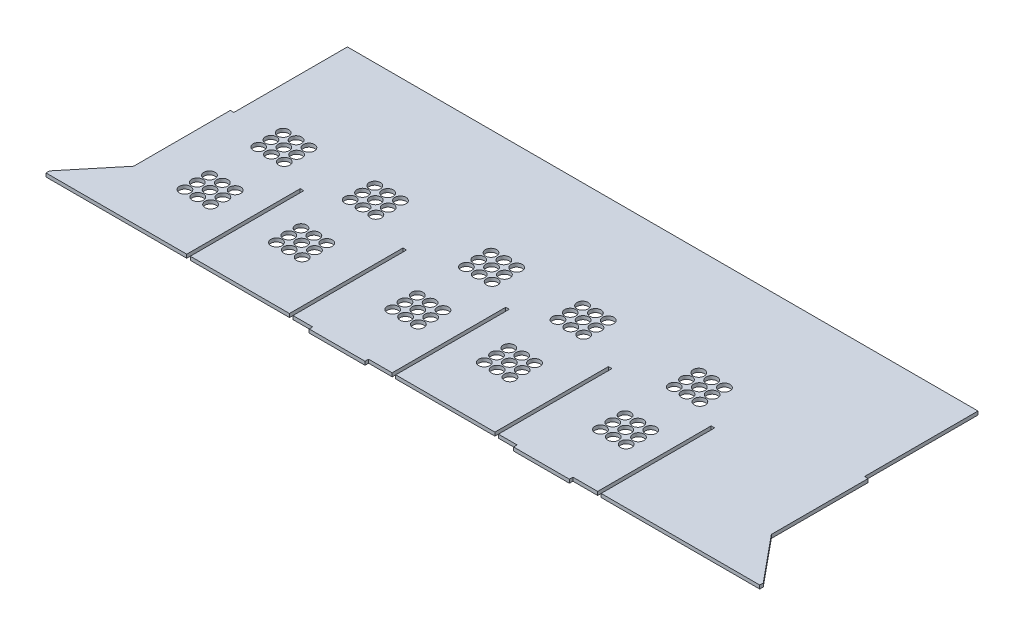
from build123d import *

# Parameters (mm, degrees)
SKETCH1_W           = 570.861
SKETCH1_H           = 3.175
BOSS_EXTRUDE1_DEPTH = 232.6
SKETCH6_W           = 50
SKETCH6_H           = 3.175
BOSS_EXTRUDE2_DEPTH = 3.175
SKETCH2_W           = 3.175
SKETCH2_H           = 101.6
CUT_EXTRUDE5_DEPTH  = 371.230335845
BOSS_EXTRUDE3_DEPTH = 3.175
SKETCH13_W          = 3.175
SKETCH13_H          = 101.6
CUT_EXTRUDE6_DEPTH  = 398.062685067
LPATTERN2_COUNT     = 5
LPATTERN2_PITCH     = 91.9550104
SKETCH21_R          = 5
CUT_EXTRUDE9_DEPTH  = 398.062685067
LPATTERN5_COUNT     = 3
LPATTERN5_PITCH     = 186
SKETCH22_R          = 5
CUT_EXTRUDE10_DEPTH = 398.062685067
LPATTERN6_COUNT     = 2
LPATTERN6_PITCH     = 186


with BuildPart() as part:
    # Sketch1 → Boss-Extrude1 (new body)
    with BuildSketch(Plane.XY):
        Rectangle(SKETCH1_W, SKETCH1_H)
    extrude(amount=BOSS_EXTRUDE1_DEPTH)

    # Sketch6 → Boss-Extrude2 (add)
    with BuildSketch(Plane.XY.offset(232.6)):
        with Locations((127.26300405, 0)):
            Rectangle(SKETCH6_W, SKETCH6_H)
        with Locations((-55.6950692, 0)):
            Rectangle(SKETCH6_W, SKETCH6_H)
    extrude(amount=BOSS_EXTRUDE2_DEPTH)

    # Sketch2 → Cut-Extrude5 (cut, through all)
    with BuildSketch(Plane(origin=(0, 1.5875, 0), x_dir=(1, 0, 0), z_dir=(0, 1, 0))):
        with Locations((283.843, -50.8)):
            Rectangle(SKETCH2_W, SKETCH2_H)
        with Locations((-283.843, -50.8)):
            Rectangle(SKETCH2_W, SKETCH2_H)
    extrude(amount=-CUT_EXTRUDE5_DEPTH, mode=Mode.SUBTRACT)

    # Sketch12 → Boss-Extrude3 (add)
    with BuildSketch(Plane(origin=(0, 1.5875, 0), x_dir=(1, 0, 0), z_dir=(0, 1, 0))):
        Polygon((-319.4665, -232.6), (-285.4305, -232.6), (-285.4305, -188.15), (-319.4665, -229.425), align=None)
    boss_extrude3 = extrude(amount=-BOSS_EXTRUDE3_DEPTH)

    # Mirror1: Boss-Extrude3 across plane
    add(boss_extrude3.mirror(Plane(origin=(0, 0, 0), x_dir=(0, 0, 1), z_dir=(1, 0, 0))))

    # Sketch13 → Cut-Extrude6 (cut, through all)
    with BuildSketch(Plane.XZ.offset(1.5875)):
        with Locations((-191.8879896, 181.8)):
            Rectangle(SKETCH13_W, SKETCH13_H)
    cut_extrude6 = extrude(amount=-CUT_EXTRUDE6_DEPTH, mode=Mode.SUBTRACT)

    # LPattern2: Cut-Extrude6 ×5
    with Locations(*[(i * LPATTERN2_PITCH, 0, 0) for i in range(1, LPATTERN2_COUNT)]):
        add(cut_extrude6, mode=Mode.SUBTRACT)

    # Sketch21 → Cut-Extrude9 (cut, through all)
    with BuildSketch(Plane(origin=(0, 1.5875, 0), x_dir=(1, 0, 0), z_dir=(0, 1, 0))):
        with Locations((-232.865497081, -95.343337061)):
            Circle(SKETCH21_R)
        with Locations((-244.365497081, -95.343337061)):
            Circle(SKETCH21_R)
        with Locations((-244.365497081, -106.343337061)):
            Circle(SKETCH21_R)
        with Locations((-244.365497081, -117.343337061)):
            Circle(SKETCH21_R)
        with Locations((-221.365497081, -106.343337061)):
            Circle(SKETCH21_R)
        with Locations((-232.865497081, -106.343337061)):
            Circle(SKETCH21_R)
        with Locations((-232.865497081, -117.343337061)):
            Circle(SKETCH21_R)
        with Locations((-221.365497081, -117.343337061)):
            Circle(SKETCH21_R)
        with Locations((-221.365497081, -95.343337061)):
            Circle(SKETCH21_R)
        with Locations((-244.365497081, -183.343337061)):
            Circle(SKETCH21_R)
        with Locations((-232.865497081, -183.343337061)):
            Circle(SKETCH21_R)
        with Locations((-221.365497081, -183.343337061)):
            Circle(SKETCH21_R)
        with Locations((-221.365497081, -172.343337061)):
            Circle(SKETCH21_R)
        with Locations((-221.365497081, -161.343337061)):
            Circle(SKETCH21_R)
        with Locations((-232.865497081, -161.343337061)):
            Circle(SKETCH21_R)
        with Locations((-232.865497081, -172.343337061)):
            Circle(SKETCH21_R)
        with Locations((-244.365497081, -172.343337061)):
            Circle(SKETCH21_R)
        with Locations((-244.365497081, -161.343337061)):
            Circle(SKETCH21_R)
    cut_extrude9 = extrude(amount=-CUT_EXTRUDE9_DEPTH, mode=Mode.SUBTRACT)

    # LPattern5: Cut-Extrude9 ×3
    with Locations(*[(i * LPATTERN5_PITCH, 0, 0) for i in range(1, LPATTERN5_COUNT)]):
        add(cut_extrude9, mode=Mode.SUBTRACT)

    # Sketch22 → Cut-Extrude10 (cut, through all)
    with BuildSketch(Plane(origin=(0, 1.5875, 0), x_dir=(1, 0, 0), z_dir=(0, 1, 0))):
        with Locations((-139.407994162, -117.343337061)):
            Circle(SKETCH22_R)
        with Locations((-150.907994162, -117.343337061)):
            Circle(SKETCH22_R)
        with Locations((-162.407994162, -117.343337061)):
            Circle(SKETCH22_R)
        with Locations((-162.407994162, -106.343337061)):
            Circle(SKETCH22_R)
        with Locations((-150.907994162, -106.343337061)):
            Circle(SKETCH22_R)
        with Locations((-139.407994162, -106.343337061)):
            Circle(SKETCH22_R)
        with Locations((-139.407994162, -95.343337061)):
            Circle(SKETCH22_R)
        with Locations((-150.907994162, -95.343337061)):
            Circle(SKETCH22_R)
        with Locations((-162.407994162, -95.343337061)):
            Circle(SKETCH22_R)
        with Locations((-139.407994162, -183.343337061)):
            Circle(SKETCH22_R)
        with Locations((-139.407994162, -172.343337061)):
            Circle(SKETCH22_R)
        with Locations((-139.407994162, -161.343337061)):
            Circle(SKETCH22_R)
        with Locations((-150.907994162, -161.343337061)):
            Circle(SKETCH22_R)
        with Locations((-150.907994162, -172.343337061)):
            Circle(SKETCH22_R)
        with Locations((-150.907994162, -183.343337061)):
            Circle(SKETCH22_R)
        with Locations((-162.407994162, -183.343337061)):
            Circle(SKETCH22_R)
        with Locations((-162.407994162, -172.343337061)):
            Circle(SKETCH22_R)
        with Locations((-162.407994162, -161.343337061)):
            Circle(SKETCH22_R)
    cut_extrude10 = extrude(amount=-CUT_EXTRUDE10_DEPTH, mode=Mode.SUBTRACT)

    # LPattern6: Cut-Extrude10 ×2
    with Locations(*[(i * LPATTERN6_PITCH, 0, 0) for i in range(1, LPATTERN6_COUNT)]):
        add(cut_extrude10, mode=Mode.SUBTRACT)


solid = part.part
